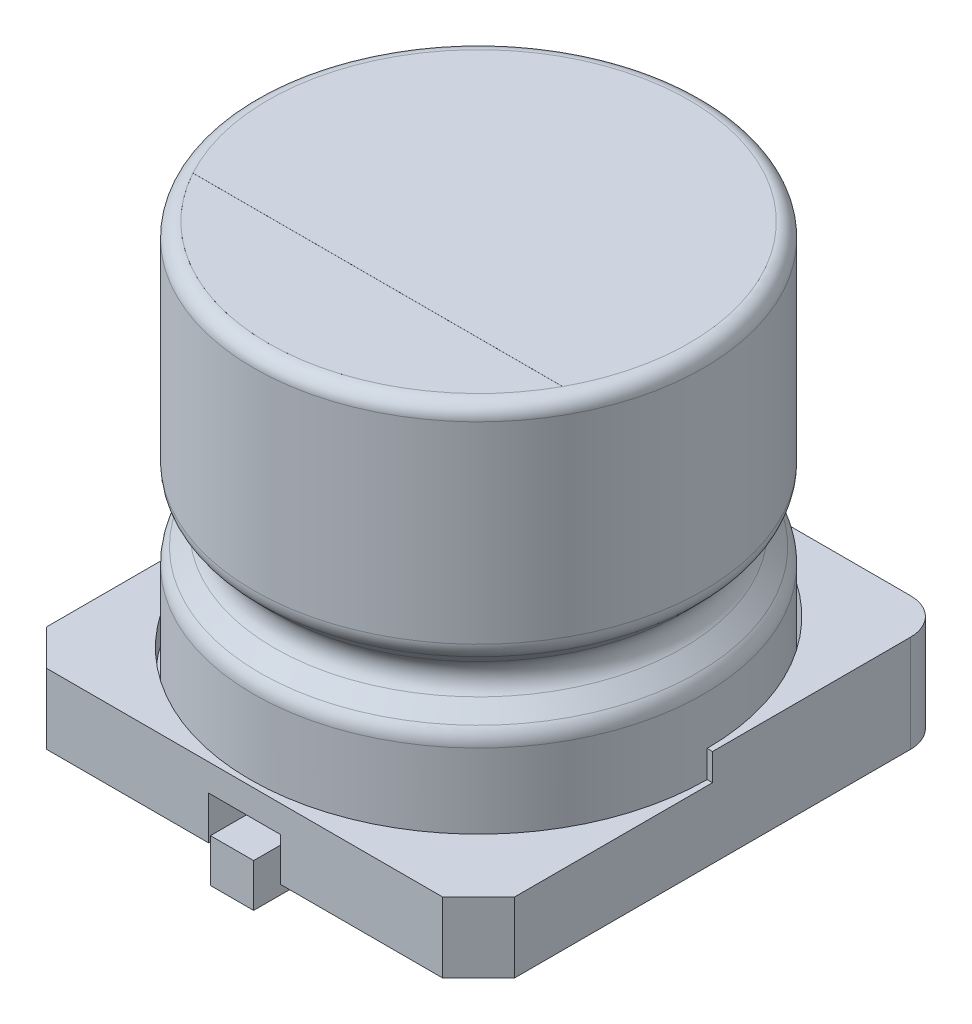
from build123d import *

# Parameters (mm, degrees)
EXTRUDE1_DEPTH     = 1.2
EXTRUDE2_START     = 1.5
SKETCH3_R          = 6.35
EXTRUDE2_DEPTH     = 1.5
EXTRUDE3_DEPTH     = 0.75
SKETCH5_R          = 0.75
EXTRUDE4_DEPTH     = 0.3
SKETCH7_W          = 1.2
SKETCH7_H          = 1.2
SCALE1_SCALE       = 0.5
CUT_EXTRUDE1_DEPTH = 0.001


with BuildPart() as part:
    # Sketch1 → Revolve1 (revolve)
    with BuildSketch(Plane.XY, mode=Mode.PRIVATE) as revolve1_sk:
        with BuildLine():
            Line((0, 0), (-6.25, 0))
            Line((-6.25, 0), (-6.25, 2.751471863))
            ThreePointArc((-6.25, 2.751471863), (-6.20432772, 2.981081922), (-6.074264069, 3.175735931))
            Line((-6.074264069, 3.175735931), (-5.674264069, 3.575735931))
            ThreePointArc((-5.674264069, 3.575735931), (-5.498528137, 4), (-5.674264069, 4.424264069))
            Line((-5.674264069, 4.424264069), (-6.074264069, 4.824264069))
            ThreePointArc((-6.074264069, 4.824264069), (-6.20432772, 5.018918078), (-6.25, 5.248528137))
            Line((-6.25, 5.248528137), (-6.25, 10.6))
            ThreePointArc((-6.25, 10.6), (-6.132842712, 10.882842712), (-5.85, 11))
            Line((-5.85, 11), (0, 11))
            Line((0, 11), (0, 0))
        make_face()
    revolve(revolve1_sk.sketch.rotate(Axis((0, 11, 0), (0, -1, 0)), 270), axis=Axis((0, 11, 0), (0, -1, 0)))

    # Sketch2 → Extrude1 (add)
    with BuildSketch(Plane.XZ):
        with BuildLine():
            Line((-6.5, 5.5), (-5.5, 6.5))
            Line((-5.5, 6.5), (-1, 6.5))
            Line((-1, 6.5), (-1, 1.6))
            Line((-1, 1.6), (1, 1.6))
            Line((1, 1.6), (1, 6.5))
            Line((1, 6.5), (5.5, 6.5))
            Line((5.5, 6.5), (6.5, 5.5))
            Line((6.5, 5.5), (6.5, -5.5))
            ThreePointArc((6.5, -5.5), (6.207106781, -6.207106781), (5.5, -6.5))
            Line((5.5, -6.5), (1, -6.5))
            Line((1, -6.5), (1, -1.6))
            Line((1, -1.6), (-1, -1.6))
            Line((-1, -1.6), (-1, -6.5))
            Line((-1, -6.5), (-5.5, -6.5))
            ThreePointArc((-5.5, -6.5), (-6.207106781, -6.207106781), (-6.5, -5.5))
            Line((-6.5, -5.5), (-6.5, 5.5))
        make_face()
    extrude(amount=EXTRUDE1_DEPTH)

    # Sketch3 → Extrude2 (add)
    with BuildSketch(Plane(origin=(0, 0, 0), x_dir=(1, 0, 0), z_dir=(0, 1, 0)).offset(EXTRUDE2_START)):
        with BuildLine():
            Line((5.5, -6.5), (-5.5, -6.5))
            Line((-5.5, -6.5), (-6.5, -5.5))
            Line((-6.5, -5.5), (-6.5, 5.5))
            ThreePointArc((-6.5, 5.5), (-6.207106781, 6.207106781), (-5.5, 6.5))
            Line((-5.5, 6.5), (5.5, 6.5))
            ThreePointArc((5.5, 6.5), (6.207106781, 6.207106781), (6.5, 5.5))
            Line((6.5, 5.5), (6.5, -5.5))
            Line((6.5, -5.5), (5.5, -6.5))
        make_face()
        with Locations(Location((0, 0, 0), (0, 0, 99.060674831))):
            Circle(SKETCH3_R, mode=Mode.SUBTRACT)
    extrude(amount=-EXTRUDE2_DEPTH)

    # Sketch4 → Extrude3 (cut)
    with BuildSketch(Plane(origin=(0, 1.5, 0), x_dir=(1, 0, 0), z_dir=(0, 1, 0))):
        with BuildLine():
            Line((-6.5, 0), (-6.35, 0))
            ThreePointArc((-6.35, 0), (0, -6.35), (6.35, 0))
            Line((6.35, 0), (6.5, 0))
            Line((6.5, 0), (6.5, -5.5))
            Line((6.5, -5.5), (5.5, -6.5))
            Line((5.5, -6.5), (-5.5, -6.5))
            Line((-5.5, -6.5), (-6.5, -5.5))
            Line((-6.5, -5.5), (-6.5, 0))
        make_face()
    extrude(amount=-EXTRUDE3_DEPTH, mode=Mode.SUBTRACT)

    # Sketch5 → Extrude4 (add)
    with BuildSketch(Plane.XZ.offset(1.2)):
        with Locations(Location((-4, 4, 0), (0, 0, 90))):
            Circle(SKETCH5_R)
        with Locations(Location((4, 4, 0), (0, 0, 90))):
            Circle(SKETCH5_R)
        with Locations(Location((-4, -4, 0), (0, 0, 90))):
            Circle(SKETCH5_R)
        with Locations(Location((4, -4, 0), (0, 0, 90))):
            Circle(SKETCH5_R)
    extrude(amount=EXTRUDE4_DEPTH)

    # Sweep1: sweep along a path in Sketch6
    with BuildLine(Plane(origin=(0, 0, 0), x_dir=(0, 0, -1), z_dir=(1, 0, 0))) as sweep1_path:
        Line((2.7, 0), (2.7, -0.05))
        ThreePointArc((2.7, -0.05), (3.051471863, -0.898528137), (3.9, -1.25))
        Line((3.9, -1.25), (6.85, -1.25))
    # Sketch7 → Sweep1 (sweep)
    with BuildSketch(Plane.XZ):
        with Locations((0, -2.7)):
            Rectangle(SKETCH7_W, SKETCH7_H)
    sweep1 = sweep(path=sweep1_path.line)

    # Mirror1: Sweep1 across plane
    add(sweep1.mirror(Plane.XY))


with BuildPart() as part_1:
    # Scale1: scaled about (0, 4.617982794, -0.053235297)
    add(part.part.scale(SCALE1_SCALE).moved(Location((0, 2.308991397, -0.026617649))))

    # Sketch8 → Cut-Extrude1 (cut)
    with BuildSketch(Plane(origin=(0, 7.808991397, 0), x_dir=(1, 0, 0), z_dir=(0, 1, 0))):
        with BuildLine():
            Line((-2.568194891, -1.373382352), (2.568194891, -1.373382352))
            ThreePointArc((2.568194891, -1.373382352), (0, -2.898382352), (-2.568194891, -1.373382352))
        make_face()
    extrude(amount=-CUT_EXTRUDE1_DEPTH, mode=Mode.SUBTRACT)


solid = part_1.part
